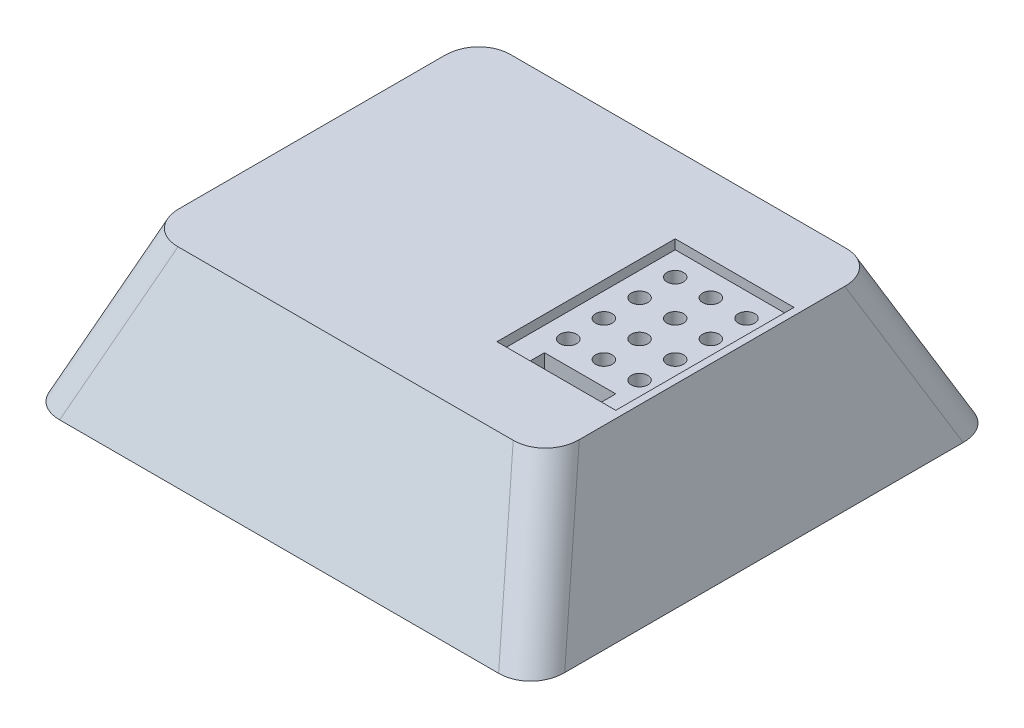
from build123d import *

# Parameters (mm, degrees)
TOP_ENCLOSURE_DEPTH                     = 65
TOP_EXTRA_DEPTH                         = 2.5
SKETCH3_W                               = 25
SKETCH3_H                               = 37.5
SOLAR_CELL_SLOT_DEPTH                   = 2
BOSS_EXTRUDE1_REACH                     = 91.819
BOSS_EXTRUDE2_REACH                     = 102.756
FILLET1_R                               = 7.5
CBORE_FOR_M5_HEX_HEAD_BOLT1_D           = 5.3
CBORE_FOR_M5_HEX_HEAD_BOLT1_DEPTH       = 10
CBORE_FOR_M5_HEX_HEAD_BOLT1_CBORE_D     = 7
CBORE_FOR_M5_HEX_HEAD_BOLT1_CBORE_DEPTH = 5
SKETCH10_R                              = 1.75
SKETCH10_W                              = 15
SKETCH10_H                              = 5
CUT_EXTRUDE1_DEPTH                      = 102.160736278


with BuildPart() as part:
    # Master_Geometry → Top_Enclosure (new body)
    with BuildSketch(Plane.XY):
        Polygon((-48, -3.5), (-53, -3.5), (-42.080892972, 26.5), (42.080892972, 26.5), (53, -3.5), (48, -3.5), (48, 4), (43, 4), (43, 11.5), (39.360297657, 21.5), (-39.360297657, 21.5), (-43, 11.5), (-43, 4), (-48, 4), align=None)
    extrude(amount=TOP_ENCLOSURE_DEPTH)

    # Sketch2 → Top_Extra (add)
    with BuildSketch(Plane.XY.offset(65)):
        Polygon((-42.080892972, 26.5), (42.080892972, 26.5), (53, -3.5), (-53, -3.5), align=None)
    top_extra = extrude(amount=TOP_EXTRA_DEPTH)

    # Mirror1: Top_Extra across plane
    add(top_extra.mirror(Plane(origin=(0, 0, 32.5), x_dir=(1, 0, 0), z_dir=(0, 0, -1))))

    # Sketch3 → Solar_Cell_Slot (cut)
    with BuildSketch(Plane(origin=(0, 26.5, 0), x_dir=(1, 0, 0), z_dir=(0, 1, 0))):
        with Locations((28.080892972, -32.5)):
            Rectangle(SKETCH3_W, SKETCH3_H)
    extrude(amount=-SOLAR_CELL_SLOT_DEPTH, mode=Mode.SUBTRACT)

    # Boss-Extrude1: up to this plane
    boss_extrude1_end = Plane(origin=(42.080892972, 26.5, 65), z_dir=(-0.9396926207859069, -0.3420201433256729, 0))
    # Sketch5 → Boss-Extrude1 (add, up to the surface)
    with BuildSketch(Plane(origin=(0, 0, 0), x_dir=(0, 0, -1), z_dir=(1, 0, 0)), mode=Mode.PRIVATE) as boss_extrude1_sk1:
        Polygon((-67.5, 26.5), (-67.5, -3.5), (-81.489229745, -3.5), align=None)
    boss_extrude1_tool1 = split(extrude(boss_extrude1_sk1.sketch, amount=BOSS_EXTRUDE1_REACH, mode=Mode.PRIVATE), bisect_by=boss_extrude1_end, keep=Keep.BOTH, mode=Mode.PRIVATE)
    boss_extrude1 = boss_extrude1_tool1.solids().sort_by_distance((0, 6.5, 72.163077))[0]
    add(boss_extrude1)

    # Boss-Extrude2: up to this face of the body (flat: up to its plane)
    boss_extrude2_end = Plane(part.part.faces().sort_by_distance((-47.540446486, 11.5, 32.5))[0])
    # Sketch6 → Boss-Extrude2 (add, up to the picked face)
    with BuildSketch(Plane.ZY, mode=Mode.PRIVATE) as boss_extrude2_sk1:
        Polygon((67.5, 26.5), (81.489229745, -3.5), (67.5, -3.5), align=None)
    boss_extrude2_tool1 = split(extrude(boss_extrude2_sk1.sketch, amount=BOSS_EXTRUDE2_REACH, mode=Mode.PRIVATE), bisect_by=boss_extrude2_end, keep=Keep.BOTH, mode=Mode.PRIVATE)
    boss_extrude2 = boss_extrude2_tool1.solids().sort_by(Axis((0, 6.5, 72.163077), (-1, 0, 0)))[0]
    add(boss_extrude2)

    # Mirror3: Boss-Extrude1, Boss-Extrude2 across plane
    add(boss_extrude1.mirror(Plane(origin=(0, 0, 32.5), x_dir=(1, 0, 0), z_dir=(0, 0, -1))))
    add(boss_extrude2.mirror(Plane(origin=(0, 0, 32.5), x_dir=(1, 0, 0), z_dir=(0, 0, -1))))

    # Fillet1
    fillet1_edges = [part.edges().sort_by_distance(p)[0] for p in [
        (47.540446486, 11.5, -9.494614872),
        (-47.540446486, 11.5, -9.494614872),
        (47.540446486, 11.5, 74.494614872),
        (-47.540446486, 11.5, 74.494614872),
    ]]
    fillet(fillet1_edges, radius=FILLET1_R)

    # CBORE for M5 Hex Head Bolt1
    with Locations(Plane(origin=(0, -3.5, 0), x_dir=(-1, 0, 0), z_dir=(0, -1, 0))):
        with Locations((35, -69.489229745), (0, -69.489229745), (-35, -69.489229745), (-35, 4.489229745), (0, 4.489229745), (35, 4.489229745)):
            CounterBoreHole(CBORE_FOR_M5_HEX_HEAD_BOLT1_D / 2, CBORE_FOR_M5_HEX_HEAD_BOLT1_CBORE_D / 2, CBORE_FOR_M5_HEX_HEAD_BOLT1_CBORE_DEPTH, depth=CBORE_FOR_M5_HEX_HEAD_BOLT1_DEPTH)

    # Sketch10 → Cut-Extrude1 (cut, through all)
    with BuildSketch(Plane(origin=(0, 24.5, 0), x_dir=(1, 0, 0), z_dir=(0, 1, 0))):
        with Locations(Location((20.580892972, -18.75, 0), (0, 0, 270))):
            Circle(SKETCH10_R)
        with Locations(Location((28.080892972, -18.75, 0), (0, 0, 270))):
            Circle(SKETCH10_R)
        with Locations(Location((35.580892972, -18.75, 0), (0, 0, 270))):
            Circle(SKETCH10_R)
        with Locations(Location((35.580892972, -26.25, 0), (0, 0, 270))):
            Circle(SKETCH10_R)
        with Locations(Location((28.080892972, -26.25, 0), (0, 0, 270))):
            Circle(SKETCH10_R)
        with Locations(Location((20.580892972, -26.25, 0), (0, 0, 270))):
            Circle(SKETCH10_R)
        with Locations(Location((35.580892972, -33.75, 0), (0, 0, 270))):
            Circle(SKETCH10_R)
        with Locations(Location((28.080892972, -33.75, 0), (0, 0, 270))):
            Circle(SKETCH10_R)
        with Locations(Location((20.580892972, -33.75, 0), (0, 0, 270))):
            Circle(SKETCH10_R)
        with Locations(Location((35.580892972, -41.25, 0), (0, 0, 270))):
            Circle(SKETCH10_R)
        with Locations(Location((28.080892972, -41.25, 0), (0, 0, 270))):
            Circle(SKETCH10_R)
        with Locations(Location((20.580892972, -41.25, 0), (0, 0, 270))):
            Circle(SKETCH10_R)
        with Locations((28.080892972, -48.75)):
            Rectangle(SKETCH10_W, SKETCH10_H)
    extrude(amount=-CUT_EXTRUDE1_DEPTH, mode=Mode.SUBTRACT)


solid = part.part
